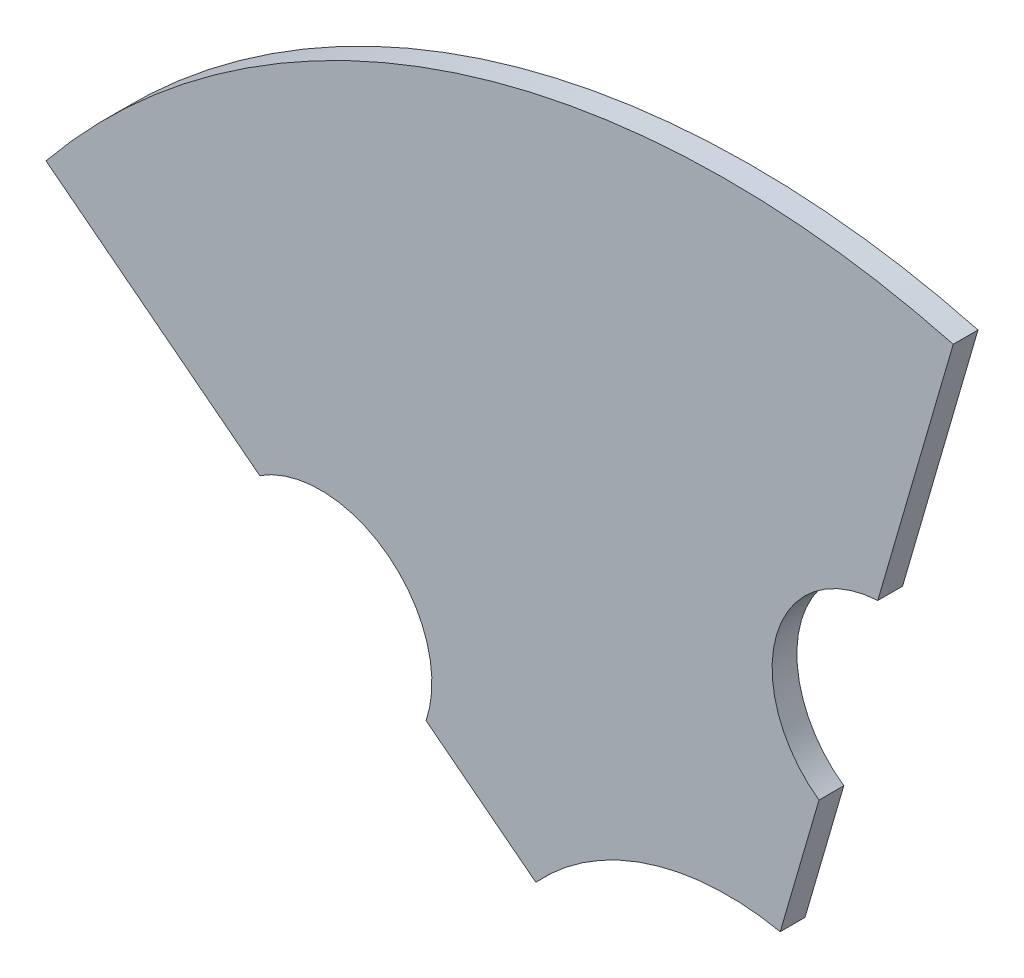
from build123d import *

# Parameters (mm, degrees)
BOSS_EXTRUDE1_DEPTH = 1.27
CUT_EXTRUDE1_DEPTH  = 58.066131866


with BuildPart() as part:
    # Sketch13 → Boss-Extrude1 (new body)
    with BuildSketch(Plane.XY):
        with BuildLine():
            Line((11.551437691, 43.580058654), (2.682196049, 13.0624672))
            ThreePointArc((2.682196049, 13.0624672), (-4.12074162, 12.682338645), (-9.847867764, 8.991202672))
            Line((-9.847867764, 8.991202672), (-34.961025172, 28.467243349))
            ThreePointArc((-34.961025172, 28.467243349), (-13.932031191, 42.878383037), (11.551437691, 43.580058654))
        make_face()
    extrude(amount=-BOSS_EXTRUDE1_DEPTH)

    # Sketch15 → Cut-Extrude1 (cut, through all)
    with BuildSketch(Plane.XY):
        with BuildLine():
            Line((7.682261651, 30.266864763), (4.669640038, 19.900932781))
            ThreePointArc((4.669640038, 19.900932781), (2.491973647, 26.154562688), (7.682261651, 30.266864763))
        make_face()
        with BuildLine():
            Line((-24.005496972, 19.970887857), (-15.475292944, 13.355447276))
            ThreePointArc((-15.475292944, 13.355447276), (-17.389315258, 19.694740336), (-24.005496972, 19.970887857))
        make_face()
    extrude(amount=-CUT_EXTRUDE1_DEPTH, mode=Mode.SUBTRACT)


solid = part.part
